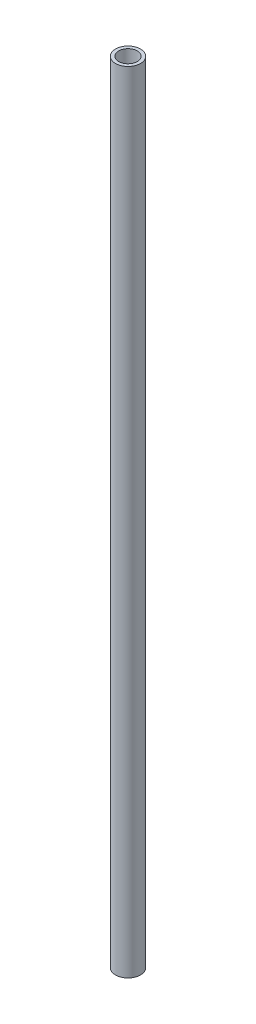
from build123d import *

# Parameters (mm, degrees)
SKETCH1_R           = 6.35
SKETCH1_R_2         = 4.699
BOSS_EXTRUDE1_DEPTH = 400.05


with BuildPart() as part:
    # Sketch1 → Boss-Extrude1 (new body)
    with BuildSketch(Plane(origin=(0, 0, 0), x_dir=(1, 0, 0), z_dir=(0, 1, 0))):
        with Locations(Location((0, 0, 0), (0, 0, 90))):
            Circle(SKETCH1_R)
        with Locations(Location((0, 0, 0), (0, 0, 90))):
            Circle(SKETCH1_R_2, mode=Mode.SUBTRACT)
    extrude(amount=BOSS_EXTRUDE1_DEPTH)


solid = part.part
